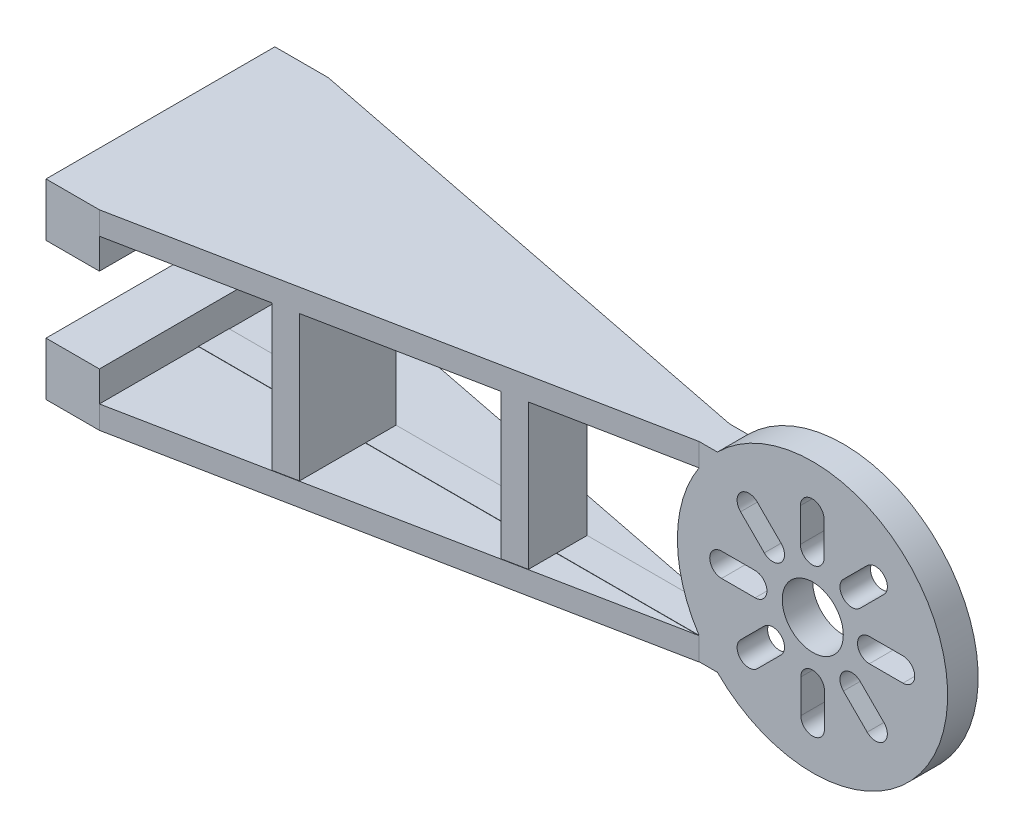
from build123d import *

# Parameters (mm, degrees)
SKETCH_1_R      = 4
EXTRUDE_3_DEPTH = 4
EXTRUDE_5_DEPTH = 3
EXTRUDE_6_DEPTH = 3
SKETCH_7_W      = 29.9977514
SKETCH_7_H      = 6.971398352
EXTRUDE_7_DEPTH = 7
EXTRUDE_8_DEPTH = 19
EXTRUDE_9_DEPTH = 19


with BuildPart() as part:
    # 草图1 → 凸台-拉伸3 (new body)
    with BuildSketch(Plane.XY):
        with BuildLine():
            Line((-39.928997061, 12.519020092), (-39.928997061, 9.519020095))
            Line((-39.928997061, 9.519020095), (25.662951423, 9.519020095))
            ThreePointArc((25.662951423, 9.519020095), (22.825216093, 0.019020096), (25.662951419, -9.480979905))
            Line((25.662951419, -9.480979905), (-39.928997061, -9.480979905))
            Line((-39.928997061, -9.480979905), (-39.928997061, -12.480979908))
            Line((-39.928997061, -12.480979908), (28.071002939, -12.480979908))
            ThreePointArc((28.071002939, -12.480979908), (58.248672468, 0.019020092), (28.071002939, 12.519020092))
            Line((28.071002939, 12.519020092), (-39.928997061, 12.519020092))
        make_face()
        with Locations((40.571002939, 0.019020092)):
            Circle(SKETCH_1_R, mode=Mode.SUBTRACT)
        with BuildLine():
            Line((28.614427542, 1.55), (33.014427542, 1.55))
            ThreePointArc((33.014427542, 1.55), (34.564427542, 0), (33.014427542, -1.55))
            Line((33.014427542, -1.55), (28.614427542, -1.55))
            ThreePointArc((28.614427542, -1.55), (27.064427542, 0), (28.614427542, 1.55))
        make_face(mode=Mode.SUBTRACT)
        with BuildLine():
            Line((52.385572458, 1.55), (47.985572458, 1.55))
            ThreePointArc((47.985572458, 1.55), (46.435572458, 0), (47.985572458, -1.55))
            Line((47.985572458, -1.55), (52.385572458, -1.55))
            ThreePointArc((52.385572458, -1.55), (53.935572458, 0), (52.385572458, 1.55))
        make_face(mode=Mode.SUBTRACT)
        with BuildLine():
            Line((42.101982847, -11.937555304), (42.101982847, -7.537555304))
            ThreePointArc((42.101982847, -7.537555304), (40.551982847, -5.987555304), (39.001982847, -7.537555304))
            Line((39.001982847, -7.537555304), (39.001982847, -11.937555304))
            ThreePointArc((39.001982847, -11.937555304), (40.551982847, -13.487555304), (42.101982847, -11.937555304))
        make_face(mode=Mode.SUBTRACT)
        with BuildLine():
            Line((33.29940699, 9.45574859), (36.410676827, 6.344478753))
            ThreePointArc((36.410676827, 6.344478753), (36.410676827, 4.152447732), (34.218645805, 4.152447732))
            Line((34.218645805, 4.152447732), (31.107375968, 7.263717569))
            ThreePointArc((31.107375968, 7.263717569), (31.107375968, 9.45574859), (33.29940699, 9.45574859))
        make_face(mode=Mode.SUBTRACT)
        with BuildLine():
            Line((42.05, 11.885572458), (42.05, 7.485572458))
            ThreePointArc((42.05, 7.485572458), (40.5, 5.935572458), (38.95, 7.485572458))
            Line((38.95, 7.485572458), (38.95, 11.885572458))
            ThreePointArc((38.95, 11.885572458), (40.5, 13.435572458), (42.05, 11.885572458))
        make_face(mode=Mode.SUBTRACT)
        with BuildLine():
            Line((47.70059301, 9.45574859), (44.589323173, 6.344478753))
            ThreePointArc((44.589323173, 6.344478753), (44.589323173, 4.152447732), (46.781354195, 4.152447732))
            Line((46.781354195, 4.152447732), (49.892624032, 7.263717569))
            ThreePointArc((49.892624032, 7.263717569), (49.892624032, 9.45574859), (47.70059301, 9.45574859))
        make_face(mode=Mode.SUBTRACT)
        with BuildLine():
            Line((33.29940699, -9.45574859), (36.410676827, -6.344478753))
            ThreePointArc((36.410676827, -6.344478753), (36.410676827, -4.152447732), (34.218645805, -4.152447732))
            Line((34.218645805, -4.152447732), (31.107375968, -7.263717569))
            ThreePointArc((31.107375968, -7.263717569), (31.107375968, -9.45574859), (33.29940699, -9.45574859))
        make_face(mode=Mode.SUBTRACT)
        with BuildLine():
            Line((47.70059301, -9.45574859), (44.589323173, -6.344478753))
            ThreePointArc((44.589323173, -6.344478753), (44.589323173, -4.152447732), (46.781354195, -4.152447732))
            Line((46.781354195, -4.152447732), (49.892624032, -7.263717569))
            ThreePointArc((49.892624032, -7.263717569), (49.892624032, -9.45574859), (47.70059301, -9.45574859))
        make_face(mode=Mode.SUBTRACT)
    extrude(amount=EXTRUDE_3_DEPTH)

    # 草图2 → 凸台-拉伸5 (add)
    with BuildSketch(Plane(origin=(0, 12.519020092, 0), x_dir=(1, 0, 0), z_dir=(0, 1, 0))):
        Polygon((-39.928997061, 0), (-39.928997061, 13), (25.661002939, 0), align=None)
    extrude_5 = extrude(amount=-EXTRUDE_5_DEPTH)

    # 镜向1: 凸台-拉伸5 across plane
    add(extrude_5.mirror(Plane.ZX))

    # 草图5 → 凸台-拉伸6 (add)
    with BuildSketch(Plane(origin=(0, 12.519020092, 0), x_dir=(1, 0, 0), z_dir=(0, 1, 0))):
        Polygon((-39.928997061, -4), (-39.928997061, -17), (25.661002939, -4), align=None)
    extrude_6 = extrude(amount=-EXTRUDE_6_DEPTH)

    # 镜向2: 凸台-拉伸6 across plane
    add(extrude_6.mirror(Plane.ZX))

    # 草图7 → 凸台-拉伸7 (add)
    with BuildSketch(Plane.ZY.offset(39.928997061)):
        with Locations((1.9988757, 9.033320916)):
            Rectangle(SKETCH_7_W, SKETCH_7_H)
    extrude_7 = extrude(amount=EXTRUDE_7_DEPTH)

    # 镜向3: 凸台-拉伸7 across plane
    add(extrude_7.mirror(Plane.ZX))

    # 草图8 → 凸台-拉伸8 (add)
    with BuildSketch(Plane.XZ.offset(-9.519020095)):
        Polygon((-21.039670639, 0), (-18.039670639, 0), (-18.039670639, 12.661514812), (-21.039670639, 13.256117648), align=None)
    extrude(amount=EXTRUDE_8_DEPTH)

    # 草图9 → 凸台-拉伸9 (add)
    with BuildSketch(Plane.XZ.offset(-9.519020095)):
        Polygon((4, 0), (7, 0), (7, 7.698628422), (4, 8.293231258), align=None)
    extrude(amount=EXTRUDE_9_DEPTH)


solid = part.part
